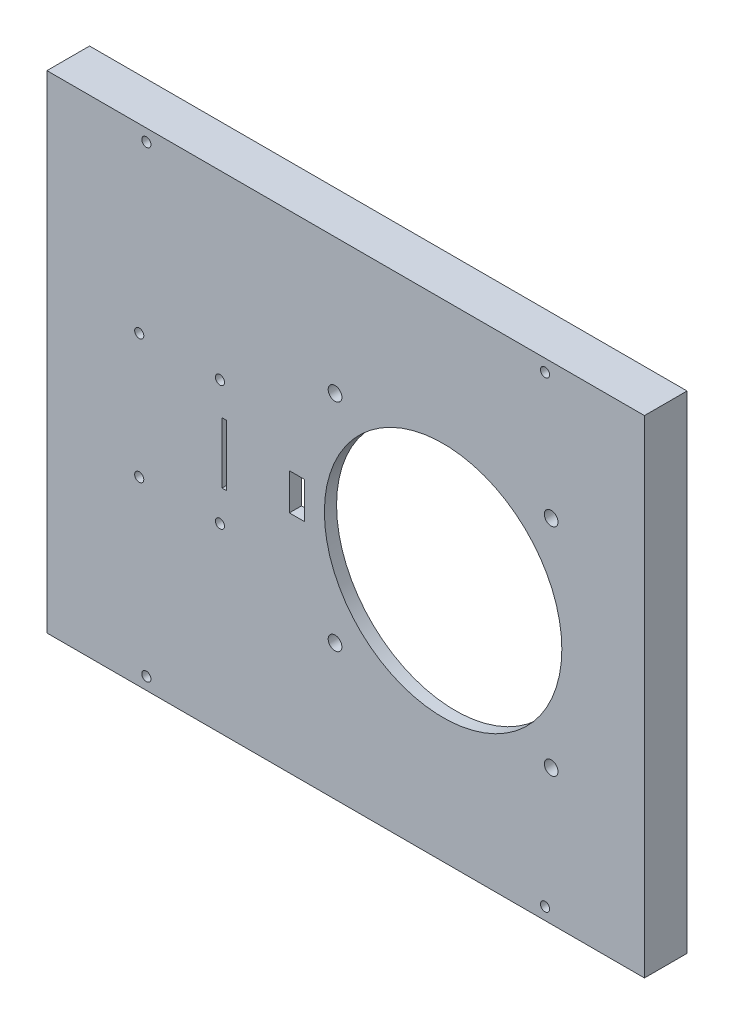
from build123d import *

# Parameters (mm, degrees)
SCHIZZO1_W                   = 196.27671429
SCHIZZO1_H                   = 160
SCHIZZO1_W_2                 = 160
SCHIZZO1_H_2                 = 146
ESTRUSIONE_ESTRUSIONE1_DEPTH = 10
SCHIZZO2_W                   = 196.27671429
SCHIZZO2_H                   = 160
ESTRUSIONE_ESTRUSIONE2_DEPTH = 4
SCHIZZO3_R                   = 1.5
TAGLIO_ESTRUSIONE1_DEPTH     = 93
SCHIZZO4_R                   = 39
SCHIZZO4_R_2                 = 2.25
SCHIZZO4_R_3                 = 1.5
SCHIZZO4_W                   = 5
SCHIZZO4_H                   = 12
SCHIZZO4_W_2                 = 1.5
SCHIZZO4_H_2                 = 20
TAGLIO_ESTRUSIONE2_DEPTH     = 90


with BuildPart() as part:
    # Schizzo1 → Estrusione-Estrusione1 (new body)
    with BuildSketch(Plane.XY):
        Rectangle(SCHIZZO1_W, SCHIZZO1_H)
        Rectangle(SCHIZZO1_W_2, SCHIZZO1_H_2, mode=Mode.SUBTRACT)
    extrude(amount=ESTRUSIONE_ESTRUSIONE1_DEPTH)

    # Schizzo2 → Estrusione-Estrusione2 (add)
    with BuildSketch(Plane.XY.offset(10)):
        Rectangle(SCHIZZO2_W, SCHIZZO2_H)
    extrude(amount=ESTRUSIONE_ESTRUSIONE2_DEPTH)

    # Schizzo3 → Taglio-Estrusione1 (cut)
    with BuildSketch(Plane(origin=(0, 0, 0), x_dir=(-1, 0, 0), z_dir=(0, 0, -1))):
        with Locations((65.48331215, 76)):
            Circle(SCHIZZO3_R)
        with Locations(Location((-65.48331215, 76, 0), (0, 0, 180))):
            Circle(SCHIZZO3_R)
        with Locations((-65.48331215, -76)):
            Circle(SCHIZZO3_R)
        with Locations(Location((65.48331215, -76, 0), (0, 0, 180))):
            Circle(SCHIZZO3_R)
    extrude(amount=-TAGLIO_ESTRUSIONE1_DEPTH, mode=Mode.SUBTRACT)

    # Schizzo4 → Taglio-Estrusione2 (cut)
    with BuildSketch(Plane(origin=(0, 0, 10), x_dir=(-1, 0, 0), z_dir=(0, 0, -1))):
        with Locations((-32, 0)):
            Circle(SCHIZZO4_R)
        with Locations((3.499999997, 35.499999997)):
            Circle(SCHIZZO4_R_2)
        with Locations((3.499999997, -35.499999997)):
            Circle(SCHIZZO4_R_2)
        with Locations((-67.499999997, 35.499999997)):
            Circle(SCHIZZO4_R_2)
        with Locations((-67.499999997, -35.499999997)):
            Circle(SCHIZZO4_R_2)
        with Locations((41.299094201, 20.449190864)):
            Circle(SCHIZZO4_R_3)
        with Locations((41.299094201, -20.449190864)):
            Circle(SCHIZZO4_R_3)
        with Locations((67.823483409, -20.449190864)):
            Circle(SCHIZZO4_R_3)
        with Locations((67.823483409, 20.449190864)):
            Circle(SCHIZZO4_R_3)
        with Locations((16, 0)):
            Rectangle(SCHIZZO4_W, SCHIZZO4_H)
        with Locations((39.87257761, 0)):
            Rectangle(SCHIZZO4_W_2, SCHIZZO4_H_2)
    extrude(amount=-TAGLIO_ESTRUSIONE2_DEPTH, mode=Mode.SUBTRACT)


solid = part.part
